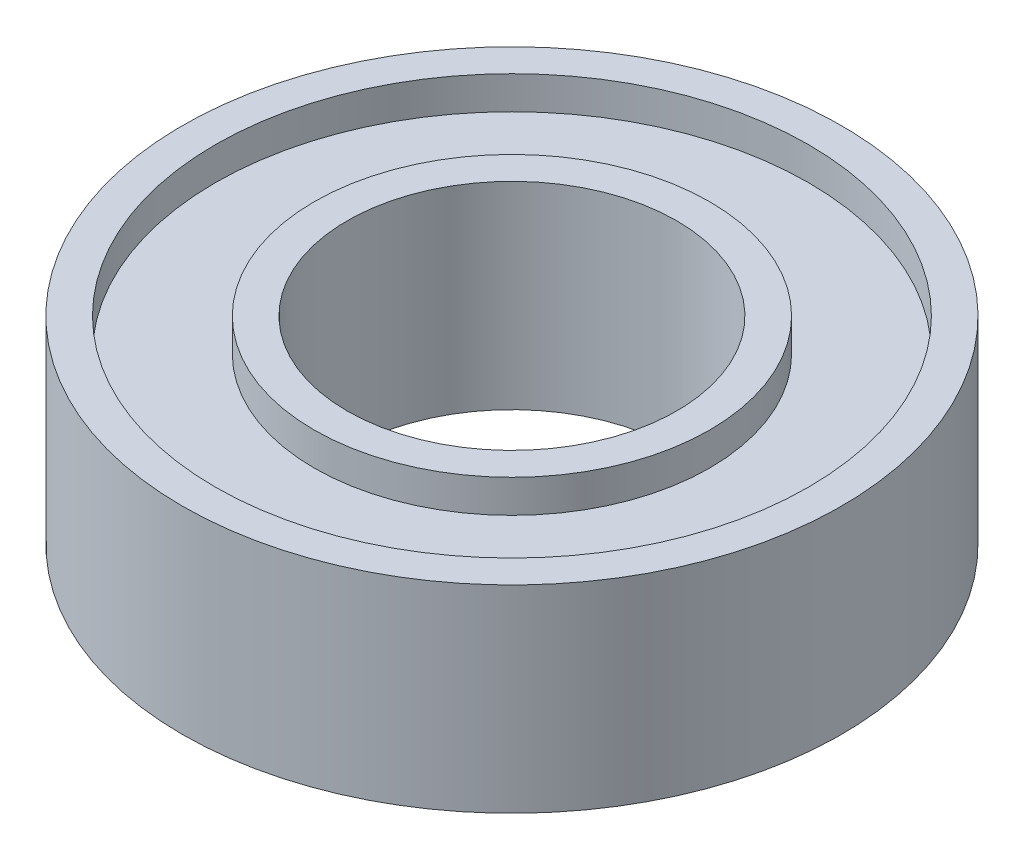
from build123d import *

# Parameters (mm, degrees)
SKETCH1_R            = 10
MAIN_EXTRUSION_DEPTH = 6
SKETCH2_R            = 5
ID_BORE_DEPTH        = 20
SKETCH3_R            = 9
SKETCH3_R_2          = 6
SEAL_RECESS_DEPTH    = 1


with BuildPart() as part:
    # Sketch1 → main extrusion (new body)
    with BuildSketch(Plane(origin=(0, 0, 0), x_dir=(1, 0, 0), z_dir=(0, 1, 0))):
        with Locations(Location((0, 0, 0), (0, 0, 270))):
            Circle(SKETCH1_R)
    extrude(amount=MAIN_EXTRUSION_DEPTH)

    # Sketch2 → ID bore (cut)
    with BuildSketch(Plane(origin=(0, 6, 0), x_dir=(1, 0, 0), z_dir=(0, 1, 0))):
        with Locations(Location((0, 0, 0), (0, 0, 270))):
            Circle(SKETCH2_R)
    extrude(amount=-ID_BORE_DEPTH, mode=Mode.SUBTRACT)

    # Sketch3 → seal recess (cut)
    with BuildSketch(Plane(origin=(0, 6, 0), x_dir=(1, 0, 0), z_dir=(0, 1, 0))):
        with Locations(Location((0, 0, 0), (0, 0, 270))):
            Circle(SKETCH3_R)
        with Locations(Location((0, 0, 0), (0, 0, 270))):
            Circle(SKETCH3_R_2, mode=Mode.SUBTRACT)
    extrude(amount=-SEAL_RECESS_DEPTH, mode=Mode.SUBTRACT)


solid = part.part
